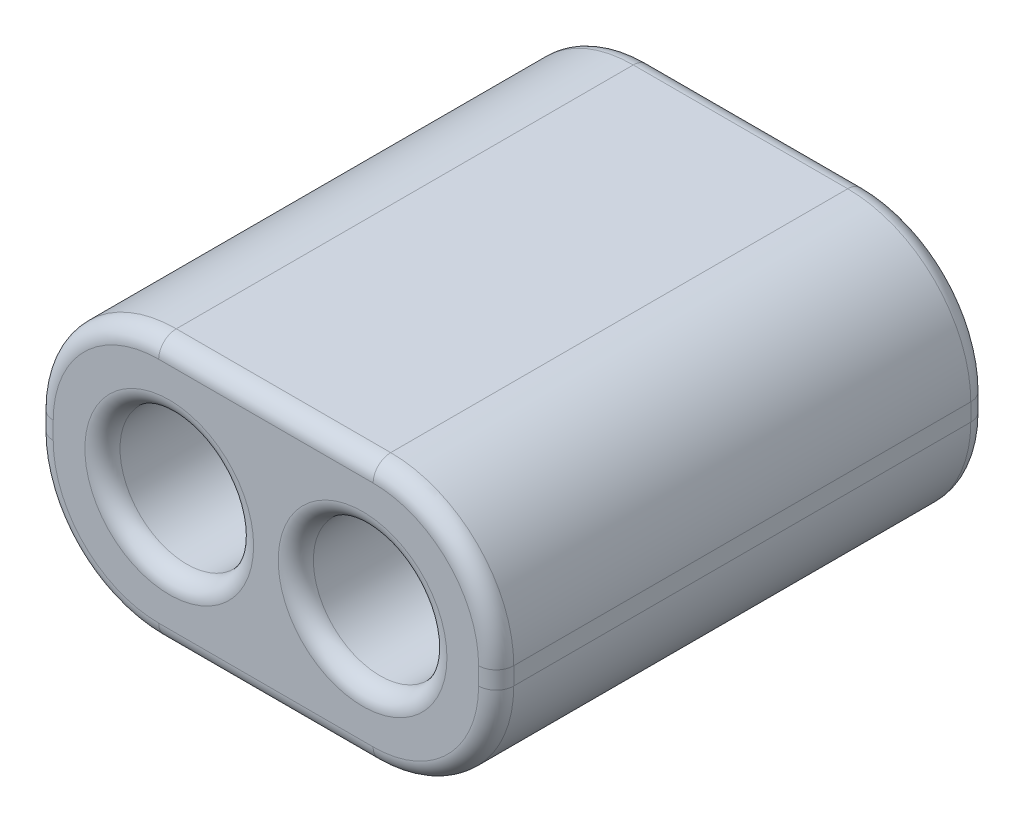
from build123d import *

# Parameters (mm, degrees)
SKETCH_1_W      = 13.1
SKETCH_1_H      = 7.5
SKETCH_1_R      = 1.9
EXTRUDE_1_DEPTH = 14
FILLET_1_R      = 3.5
FILLET_2_R      = 0.5
FILLET_3_R      = 0.5


with BuildPart() as part:
    # Эскиз1 → Бобышка-Вытянуть1 (new body)
    with BuildSketch(Plane.XY):
        Rectangle(SKETCH_1_W, SKETCH_1_H)
        with Locations((-2.75, 0)):
            Circle(SKETCH_1_R, mode=Mode.SUBTRACT)
        with Locations((2.75, 0)):
            Circle(SKETCH_1_R, mode=Mode.SUBTRACT)
    extrude(amount=EXTRUDE_1_DEPTH)

    # Скругление1
    fillet_1_edges = [part.edges().sort_by_distance(p)[0] for p in [
        (6.55, -3.75, 7),
        (-6.55, -3.75, 7),
        (-6.55, 3.75, 7),
        (6.55, 3.75, 7),
    ]]
    fillet(fillet_1_edges, radius=FILLET_1_R)

    # Скругление2
    fillet_2_edges = [part.edges().sort_by_distance(p)[0] for p in [
        (-4.65, 0, 14),
        (0.85, 0, 14),
        (6.55, 0, 14),
        (0, -3.75, 14),
        (0, 3.75, 14),
        (-6.55, 0, 14),
        (5.524873734, 2.724873734, 14),
        (-5.524873734, 2.724873734, 14),
        (-5.524873734, -2.724873734, 14),
        (5.524873734, -2.724873734, 14),
    ]]
    fillet(fillet_2_edges, radius=FILLET_2_R)

    # Скругление3
    fillet_3_edges = [part.edges().sort_by_distance(p)[0] for p in [
        (-4.65, 0, 0),
        (0.85, 0, 0),
        (6.55, 0, 0),
        (0, -3.75, 0),
        (-6.55, 0, 0),
        (0, 3.75, 0),
        (5.524873734, 2.724873734, 0),
        (-5.524873734, 2.724873734, 0),
        (-5.524873734, -2.724873734, 0),
        (5.524873734, -2.724873734, 0),
    ]]
    fillet(fillet_3_edges, radius=FILLET_3_R)


solid = part.part
